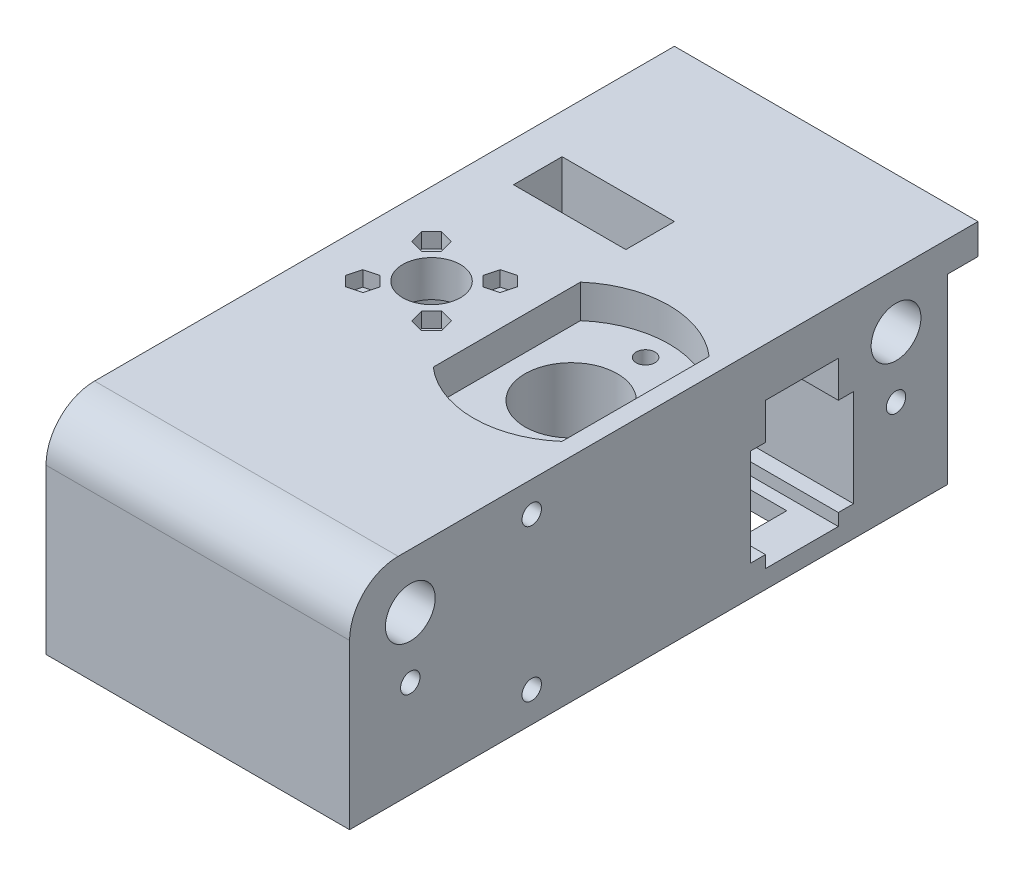
from build123d import *

# Parameters (mm, degrees)
BOSS_EXTRUDE1_DEPTH            = 50
SKETCH2_R                      = 7.6
SKETCH2_R_2                    = 4.75
SKETCH2_R_3                    = 1.55
SKETCH2_R_4                    = 1.05
CUT_EXTRUDE1_DEPTH             = 116.876011322
CUT_EXTRUDE2_DEPTH             = 5.5
SKETCH4_R                      = 11
CUT_EXTRUDE3_DEPTH             = 29
CUT_EXTRUDE4_DEPTH             = 5
CUT_EXTRUDE5_DEPTH             = 2.5
SKETCH7_R                      = 4.1
SKETCH7_R_2                    = 1.6
SKETCH7_W                      = 12
SKETCH7_H                      = 24
CUT_EXTRUDE6_DEPTH             = 116.876011322
CUT_EXTRUDE7_DEPTH             = 35
SKETCH9_W                      = 17
SKETCH9_H                      = 16
CUT_EXTRUDE8_DEPTH             = 48
CUT_EXTRUDE9_REACH             = 117.876
SKETCH10_W                     = 37
SKETCH10_H                     = 8
CUT_EXTRUDE9_DIRECTION_2_DEPTH = 116.876011322
CUT_EXTRUDE10_REACH            = 115.716
SKETCH11_W                     = 18.5
SKETCH11_H                     = 8
FILLET1_R                      = 8


with BuildPart() as part:
    # Sketch1 → Boss-Extrude1 (new body)
    with BuildSketch(Plane(origin=(0, 0, 0), x_dir=(0, 0, -1), z_dir=(1, 0, 0))):
        Polygon((0, 0), (0, 30), (5, 30), (5, 35), (-98.5, 35), (-98.5, 0), align=None)
    extrude(amount=BOSS_EXTRUDE1_DEPTH)

    # Sketch2 → Cut-Extrude1 (cut, through all)
    with BuildSketch(Plane(origin=(0, 35, 0), x_dir=(1, 0, 0), z_dir=(0, 1, 0))):
        with Locations(Location((36.5, -48.5, 0), (0, 0, 270))):
            Circle(SKETCH2_R)
        with Locations(Location((13.5, -48.5, 0), (0, 0, 270))):
            Circle(SKETCH2_R_2)
        with Locations(Location((36.5, -36.25, 0), (0, 0, 270))):
            Circle(SKETCH2_R_3)
        with Locations(Location((36.5, -60.75, 0), (0, 0, 270))):
            Circle(SKETCH2_R_3)
        with Locations(Location((19.156854249, -42.843145751, 0), (0, 0, 270))):
            Circle(SKETCH2_R_4)
        with Locations(Location((19.156854249, -54.156854249, 0), (0, 0, 270))):
            Circle(SKETCH2_R_4)
        with Locations(Location((7.843145751, -54.156854249, 0), (0, 0, 270))):
            Circle(SKETCH2_R_4)
        with Locations(Location((7.843145751, -42.843145751, 0), (0, 0, 270))):
            Circle(SKETCH2_R_4)
    extrude(amount=-CUT_EXTRUDE1_DEPTH, mode=Mode.SUBTRACT)

    # Sketch3 → Cut-Extrude2 (cut)
    with BuildSketch(Plane(origin=(0, 35, 0), x_dir=(1, 0, 0), z_dir=(0, 1, 0))):
        with BuildLine():
            Line((25.9, -36.381831822), (25.9, -60.618168178))
            ThreePointArc((25.9, -60.618168178), (36.5, -64.6), (47.1, -60.618168178))
            Line((47.1, -60.618168178), (47.1, -36.381831822))
            ThreePointArc((47.1, -36.381831822), (36.5, -32.4), (25.9, -36.381831822))
        make_face()
    extrude(amount=-CUT_EXTRUDE2_DEPTH, mode=Mode.SUBTRACT)

    # Sketch4 → Cut-Extrude3 (cut)
    with BuildSketch(Plane.XZ):
        with Locations(Location((13.5, 48.5, 0), (0, 0, 270))):
            Circle(SKETCH4_R)
    extrude(amount=-CUT_EXTRUDE3_DEPTH, mode=Mode.SUBTRACT)

    # Sketch5 → Cut-Extrude4 (cut)
    with BuildSketch(Plane.XZ):
        Polygon((39.725, 60.75), (38.1125, 63.542931927), (34.8875, 63.542931927), (33.275, 60.75), (34.8875, 57.957068073), (38.1125, 57.957068073), align=None)
        Polygon((38.1125, 39.042931927), (34.8875, 39.042931927), (33.275, 36.25), (34.8875, 33.457068073), (38.1125, 33.457068073), (39.725, 36.25), align=None)
    extrude(amount=-CUT_EXTRUDE4_DEPTH, mode=Mode.SUBTRACT)

    # Sketch6 → Cut-Extrude5 (cut)
    with BuildSketch(Plane(origin=(0, 35, 0), x_dir=(1, 0, 0), z_dir=(0, 1, 0))):
        Polygon((21.388142908, -42.245273756), (19.754726244, -40.611857092), (17.523437585, -41.209729086), (16.925565591, -43.441017745), (18.558982255, -45.074434409), (20.790270914, -44.476562415), align=None)
        Polygon((21.388142908, -54.754726244), (20.790270914, -52.523437585), (18.558982255, -51.925565591), (16.925565591, -53.558982255), (17.523437585, -55.790270914), (19.754726244, -56.388142908), align=None)
        Polygon((7.245273756, -56.388142908), (9.476562415, -55.790270914), (10.074434409, -53.558982255), (8.441017745, -51.925565591), (6.209729086, -52.523437585), (5.611857092, -54.754726244), align=None)
        Polygon((5.611857092, -42.245273756), (6.209729086, -44.476562415), (8.441017745, -45.074434409), (10.074434409, -43.441017745), (9.476562415, -41.209729086), (7.245273756, -40.611857092), align=None)
    extrude(amount=-CUT_EXTRUDE5_DEPTH, mode=Mode.SUBTRACT)

    # Sketch7 → Cut-Extrude6 (cut, through all)
    with BuildSketch(Plane(origin=(50, 0, 0), x_dir=(0, 0, -1), z_dir=(1, 0, 0))):
        with Locations((-8.5, 26)):
            Circle(SKETCH7_R)
        with Locations((-88.5, 26)):
            Circle(SKETCH7_R)
        with Locations((-88.5, 16)):
            Circle(SKETCH7_R_2)
        with Locations((-8.5, 16)):
            Circle(SKETCH7_R_2)
        with Locations((-68.5, 30)):
            Circle(SKETCH7_R_2)
        with Locations((-68.5, 5)):
            Circle(SKETCH7_R_2)
        with Locations((-24, 15)):
            Rectangle(SKETCH7_W, SKETCH7_H)
    extrude(amount=-CUT_EXTRUDE6_DEPTH, mode=Mode.SUBTRACT)

    # Sketch8 → Cut-Extrude7 (cut)
    with BuildSketch(Plane.ZY):
        Polygon((11.725, 16), (10.1125, 18.792931927), (6.8875, 18.792931927), (5.275, 16), (6.8875, 13.207068073), (10.1125, 13.207068073), align=None)
        Polygon((65.275, 30), (66.8875, 27.207068073), (70.1125, 27.207068073), (71.725, 30), (70.1125, 32.792931927), (66.8875, 32.792931927), align=None)
        Polygon((65.275, 5), (66.8875, 2.207068073), (70.1125, 2.207068073), (71.725, 5), (70.1125, 7.792931927), (66.8875, 7.792931927), align=None)
        Polygon((85.275, 16), (86.8875, 13.207068073), (90.1125, 13.207068073), (91.725, 16), (90.1125, 18.792931927), (86.8875, 18.792931927), align=None)
    extrude(amount=-CUT_EXTRUDE7_DEPTH, mode=Mode.SUBTRACT)

    # Sketch9 → Cut-Extrude8 (cut)
    with BuildSketch(Plane(origin=(50, 0, 0), x_dir=(0, 0, -1), z_dir=(1, 0, 0))):
        with Locations((-24, 13)):
            Rectangle(SKETCH9_W, SKETCH9_H)
    extrude(amount=-CUT_EXTRUDE8_DEPTH, mode=Mode.SUBTRACT)

    # Sketch10 → Cut-Extrude9 (cut, up to next)
    with BuildSketch(Plane.XZ, mode=Mode.PRIVATE) as cut_extrude9_sk1:
        with Locations((25, 24)):
            Rectangle(SKETCH10_W, SKETCH10_H)
    cut_extrude9_tool1 = extrude(cut_extrude9_sk1.sketch, amount=-CUT_EXTRUDE9_REACH, mode=Mode.PRIVATE) & part.part
    add(cut_extrude9_tool1.solids().sort_by_distance((25, 0, 24))[0], mode=Mode.SUBTRACT)

    # Sketch10 → Cut-Extrude9 direction 2 (cut)
    with BuildSketch(Plane.XZ):
        with Locations((25, 24)):
            Rectangle(SKETCH10_W, SKETCH10_H)
    extrude(amount=CUT_EXTRUDE9_DIRECTION_2_DEPTH, mode=Mode.SUBTRACT)

    # Sketch11 → Cut-Extrude10 (cut, up to next)
    with BuildSketch(Plane.XZ.offset(-27), mode=Mode.PRIVATE) as cut_extrude10_sk1:
        with Locations((15.75, 24)):
            Rectangle(SKETCH11_W, SKETCH11_H)
    cut_extrude10_tool1 = extrude(cut_extrude10_sk1.sketch, amount=-CUT_EXTRUDE10_REACH, mode=Mode.PRIVATE) & part.part
    add(cut_extrude10_tool1.solids().sort_by_distance((15.75, 27, 24))[0], mode=Mode.SUBTRACT)

    # Fillet1
    fillet1_edges = [part.edges().sort_by_distance(p)[0] for p in [
        (25, 35, 98.5),
    ]]
    fillet(fillet1_edges, radius=FILLET1_R)


solid = part.part
